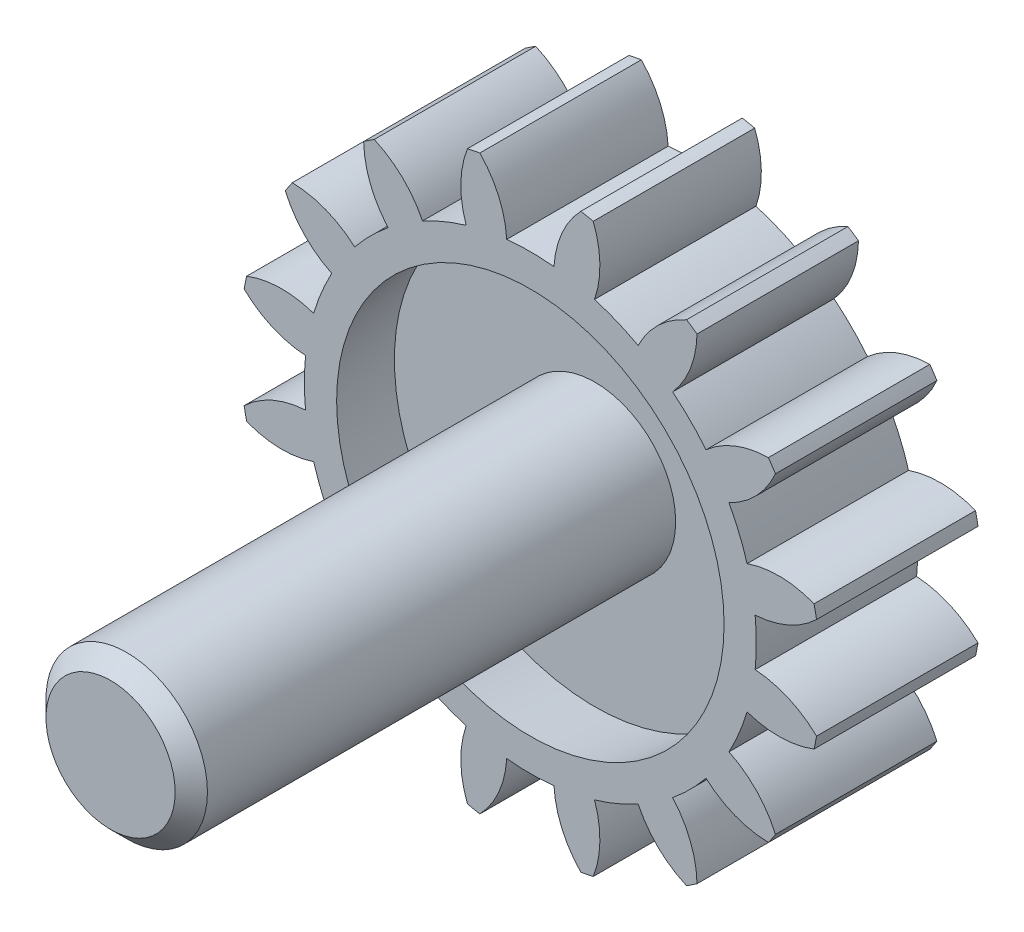
from build123d import *

# Parameters (mm, degrees)
SKETCH_1_R          = 18
EXTRUDE_1_DEPTH     = 10
CUT_EXTRUDE_2_DEPTH = 28.349588662
SKETCH_4_R          = 12
CUT_EXTRUDE_3_DEPTH = 4
CUT_EXTRUDE_3_DRAFT = 6
SKETCH_5_R          = 5
EXTRUDE_2_DEPTH     = 30
CHAMFER_1_SIZE      = 1
SKETCH_6_R          = 12
CUT_EXTRUDE_4_DEPTH = 4
CUT_EXTRUDE_4_DRAFT = 6


with BuildPart() as part:
    # Эскиз1 → Бобышка-Вытянуть1 (new body)
    with BuildSketch(Plane.XY):
        Circle(SKETCH_1_R)
    extrude(amount=-EXTRUDE_1_DEPTH)

    # Эскиз3 → Вырез-Вытянуть2 (cut, through all)
    with BuildSketch(Plane.XY):
        with BuildLine():
            ThreePointArc((1.463398486, 13.923306535), (0, 14), (-1.463398486, 13.923306535))
            ThreePointArc((-1.463398486, 13.923306535), (-1.955189123, 15.973239081), (-3.125667198, 17.726539554))
            ThreePointArc((-3.125667198, 17.726539554), (0, 18), (3.125667198, 17.726539554))
            ThreePointArc((3.125667198, 17.726539554), (1.955189123, 15.973239081), (1.463398486, 13.923306535))
        make_face()
        with BuildLine():
            ThreePointArc((6.680222644, 12.303439577), (5.357568053, 12.934313455), (3.976214826, 13.423476288))
            ThreePointArc((3.976214826, 13.423476288), (4.306334745, 15.505567139), (3.895913051, 17.573328128))
            ThreePointArc((3.895913051, 17.573328128), (6.888301783, 16.629831585), (9.67139295, 15.181046025))
            ThreePointArc((9.67139295, 15.181046025), (7.91905317, 14.009130171), (6.680222644, 12.303439577))
        make_face()
        with BuildLine():
            ThreePointArc((10.88004346, 8.810485475), (9.899494937, 9.899494937), (8.810485475, 10.88004346))
            ThreePointArc((8.810485475, 10.88004346), (9.912258185, 12.677313159), (10.324375854, 14.744736797))
            ThreePointArc((10.324375854, 14.744736797), (12.727922061, 12.727922061), (14.744736797, 10.324375854))
            ThreePointArc((14.744736797, 10.324375854), (12.677313159, 9.912258185), (10.88004346, 8.810485475))
        make_face()
        with BuildLine():
            ThreePointArc((13.423476288, 3.976214826), (12.934313455, 5.357568053), (12.303439577, 6.680222644))
            ThreePointArc((12.303439577, 6.680222644), (14.009130171, 7.91905317), (15.181046025, 9.67139295))
            ThreePointArc((15.181046025, 9.67139295), (16.629831585, 6.888301783), (17.573328128, 3.895913051))
            ThreePointArc((17.573328128, 3.895913051), (15.505567139, 4.306334745), (13.423476288, 3.976214826))
        make_face()
        with BuildLine():
            ThreePointArc((13.923306535, -1.463398486), (14, 0), (13.923306535, 1.463398486))
            ThreePointArc((13.923306535, 1.463398486), (15.973239081, 1.955189123), (17.726539554, 3.125667198))
            ThreePointArc((17.726539554, 3.125667198), (18, 0), (17.726539554, -3.125667198))
            ThreePointArc((17.726539554, -3.125667198), (15.973239081, -1.955189123), (13.923306535, -1.463398486))
        make_face()
        with BuildLine():
            ThreePointArc((12.303439577, -6.680222644), (12.934313455, -5.357568053), (13.423476288, -3.976214826))
            ThreePointArc((13.423476288, -3.976214826), (15.505567139, -4.306334745), (17.573328128, -3.895913051))
            ThreePointArc((17.573328128, -3.895913051), (16.629831585, -6.888301783), (15.181046025, -9.67139295))
            ThreePointArc((15.181046025, -9.67139295), (14.009130171, -7.91905317), (12.303439577, -6.680222644))
        make_face()
        with BuildLine():
            ThreePointArc((8.810485475, -10.88004346), (9.899494937, -9.899494937), (10.88004346, -8.810485475))
            ThreePointArc((10.88004346, -8.810485475), (12.677313159, -9.912258185), (14.744736797, -10.324375854))
            ThreePointArc((14.744736797, -10.324375854), (12.727922061, -12.727922061), (10.324375854, -14.744736797))
            ThreePointArc((10.324375854, -14.744736797), (9.912258185, -12.677313159), (8.810485475, -10.88004346))
        make_face()
        with BuildLine():
            ThreePointArc((3.976214826, -13.423476288), (5.357568053, -12.934313455), (6.680222644, -12.303439577))
            ThreePointArc((6.680222644, -12.303439577), (7.91905317, -14.009130171), (9.67139295, -15.181046025))
            ThreePointArc((9.67139295, -15.181046025), (6.888301783, -16.629831585), (3.895913051, -17.573328128))
            ThreePointArc((3.895913051, -17.573328128), (4.306334745, -15.505567139), (3.976214826, -13.423476288))
        make_face()
        with BuildLine():
            ThreePointArc((-1.463398486, -13.923306535), (0, -14), (1.463398486, -13.923306535))
            ThreePointArc((1.463398486, -13.923306535), (1.955189123, -15.973239081), (3.125667198, -17.726539554))
            ThreePointArc((3.125667198, -17.726539554), (0, -18), (-3.125667198, -17.726539554))
            ThreePointArc((-3.125667198, -17.726539554), (-1.955189123, -15.973239081), (-1.463398486, -13.923306535))
        make_face()
        with BuildLine():
            ThreePointArc((-6.680222644, -12.303439577), (-5.357568053, -12.934313455), (-3.976214826, -13.423476288))
            ThreePointArc((-3.976214826, -13.423476288), (-4.306334745, -15.505567139), (-3.895913051, -17.573328128))
            ThreePointArc((-3.895913051, -17.573328128), (-6.888301783, -16.629831585), (-9.67139295, -15.181046025))
            ThreePointArc((-9.67139295, -15.181046025), (-7.91905317, -14.009130171), (-6.680222644, -12.303439577))
        make_face()
        with BuildLine():
            ThreePointArc((-10.88004346, -8.810485475), (-9.899494937, -9.899494937), (-8.810485475, -10.88004346))
            ThreePointArc((-8.810485475, -10.88004346), (-9.912258185, -12.677313159), (-10.324375854, -14.744736797))
            ThreePointArc((-10.324375854, -14.744736797), (-12.727922061, -12.727922061), (-14.744736797, -10.324375854))
            ThreePointArc((-14.744736797, -10.324375854), (-12.677313159, -9.912258185), (-10.88004346, -8.810485475))
        make_face()
        with BuildLine():
            ThreePointArc((-13.423476288, -3.976214826), (-12.934313455, -5.357568053), (-12.303439577, -6.680222644))
            ThreePointArc((-12.303439577, -6.680222644), (-14.009130171, -7.91905317), (-15.181046025, -9.67139295))
            ThreePointArc((-15.181046025, -9.67139295), (-16.629831585, -6.888301783), (-17.573328128, -3.895913051))
            ThreePointArc((-17.573328128, -3.895913051), (-15.505567139, -4.306334745), (-13.423476288, -3.976214826))
        make_face()
        with BuildLine():
            ThreePointArc((-13.923306535, 1.463398486), (-14, 0), (-13.923306535, -1.463398486))
            ThreePointArc((-13.923306535, -1.463398486), (-15.973239081, -1.955189123), (-17.726539554, -3.125667198))
            ThreePointArc((-17.726539554, -3.125667198), (-18, 0), (-17.726539554, 3.125667198))
            ThreePointArc((-17.726539554, 3.125667198), (-15.973239081, 1.955189123), (-13.923306535, 1.463398486))
        make_face()
        with BuildLine():
            ThreePointArc((-12.303439577, 6.680222644), (-12.934313455, 5.357568053), (-13.423476288, 3.976214826))
            ThreePointArc((-13.423476288, 3.976214826), (-15.505567139, 4.306334745), (-17.573328128, 3.895913051))
            ThreePointArc((-17.573328128, 3.895913051), (-16.629831585, 6.888301783), (-15.181046025, 9.67139295))
            ThreePointArc((-15.181046025, 9.67139295), (-14.009130171, 7.91905317), (-12.303439577, 6.680222644))
        make_face()
        with BuildLine():
            ThreePointArc((-8.810485475, 10.88004346), (-9.899494937, 9.899494937), (-10.88004346, 8.810485475))
            ThreePointArc((-10.88004346, 8.810485475), (-12.677313159, 9.912258185), (-14.744736797, 10.324375854))
            ThreePointArc((-14.744736797, 10.324375854), (-12.727922061, 12.727922061), (-10.324375854, 14.744736797))
            ThreePointArc((-10.324375854, 14.744736797), (-9.912258185, 12.677313159), (-8.810485475, 10.88004346))
        make_face()
        with BuildLine():
            ThreePointArc((-3.976214826, 13.423476288), (-5.357568053, 12.934313455), (-6.680222644, 12.303439577))
            ThreePointArc((-6.680222644, 12.303439577), (-7.91905317, 14.009130171), (-9.67139295, 15.181046025))
            ThreePointArc((-9.67139295, 15.181046025), (-6.888301783, 16.629831585), (-3.895913051, 17.573328128))
            ThreePointArc((-3.895913051, 17.573328128), (-4.306334745, 15.505567139), (-3.976214826, 13.423476288))
        make_face()
    extrude(amount=-CUT_EXTRUDE_2_DEPTH, mode=Mode.SUBTRACT)


with BuildPart() as cut_extrude_3_tool:
    # Эскиз4 → Вырез-Вытянуть3 (with draft: the straight prism first)
    with BuildSketch(Plane.XY):
        Circle(SKETCH_4_R)
    extrude(amount=-CUT_EXTRUDE_3_DEPTH)
    # Вырез-Вытянуть3: the draft: its side faces are tilted about the plane it starts from
    cut_extrude_3_sides = [cut_extrude_3_tool.faces().sort_by_distance(p)[0] for p in [
        (-12, 0, -2),
    ]]
    draft(cut_extrude_3_sides, Plane.XY, CUT_EXTRUDE_3_DRAFT)


with BuildPart() as part_1:
    add(part.part)

    # Вырез-Вытянуть3: cut by cut_extrude_3_tool
    add(cut_extrude_3_tool.part, mode=Mode.SUBTRACT)

    # Эскиз5 → Бобышка-Вытянуть2 (add)
    with BuildSketch(Plane.XY.offset(-4)):
        Circle(SKETCH_5_R)
    extrude(amount=EXTRUDE_2_DEPTH)

    # Фаска1
    chamfer_1_edges = [part_1.edges().sort_by_distance(p)[0] for p in [
        (-5, 0, 26),
    ]]
    chamfer(chamfer_1_edges, length=CHAMFER_1_SIZE)


with BuildPart() as cut_extrude_4_tool:
    # Эскиз6 → Вырез-Вытянуть4 (with draft: the straight prism first)
    with BuildSketch(Plane(origin=(0, 0, -10), x_dir=(-1, 0, 0), z_dir=(0, 0, -1))):
        Circle(SKETCH_6_R)
    extrude(amount=-CUT_EXTRUDE_4_DEPTH)
    # Вырез-Вытянуть4: the draft: its side faces are tilted about the plane it starts from
    cut_extrude_4_sides = [cut_extrude_4_tool.faces().sort_by_distance(p)[0] for p in [
        (12, 0, -8),
    ]]
    draft(cut_extrude_4_sides, Plane(origin=(0, 0, -10), x_dir=(-1, 0, 0), z_dir=(0, 0, -1)), CUT_EXTRUDE_4_DRAFT)


with BuildPart() as part_2:
    add(part_1.part)

    # Вырез-Вытянуть4: cut by cut_extrude_4_tool
    add(cut_extrude_4_tool.part, mode=Mode.SUBTRACT)


solid = part_2.part
